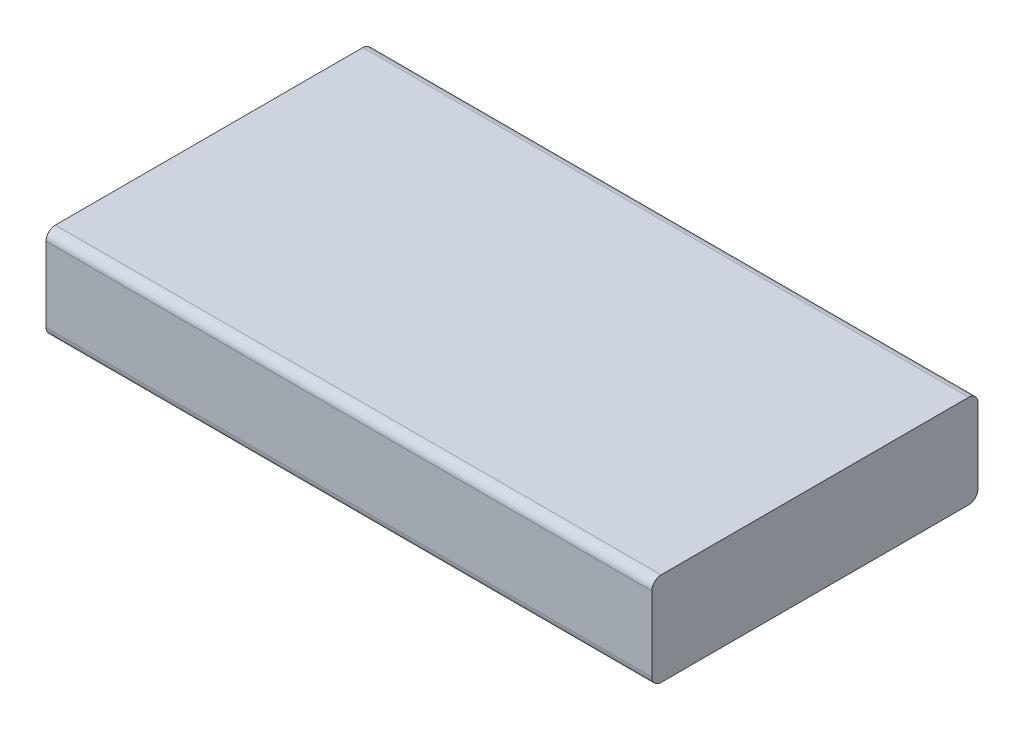
from build123d import *

# Parameters (mm, degrees)
ESBO_O1_W                = 35
ESBO_O1_H                = 10
RESSALTO_EXTRUS_O1_DEPTH = 65
FILETE2_R                = 1


with BuildPart() as part:
    # Esboço1 → Ressalto-extrusão1 (new body)
    with BuildSketch(Plane(origin=(0, 0, 0), x_dir=(0, 0, -1), z_dir=(1, 0, 0))):
        with Locations((17.5, 5)):
            Rectangle(ESBO_O1_W, ESBO_O1_H)
    extrude(amount=RESSALTO_EXTRUS_O1_DEPTH)

    # Filete2
    filete2_edges = [part.edges().sort_by_distance(p)[0] for p in [
        (32.5, 10, 0),
        (32.5, 10, -35),
        (32.5, 0, -35),
        (32.5, 0, 0),
    ]]
    fillet(filete2_edges, radius=FILETE2_R)


solid = part.part
